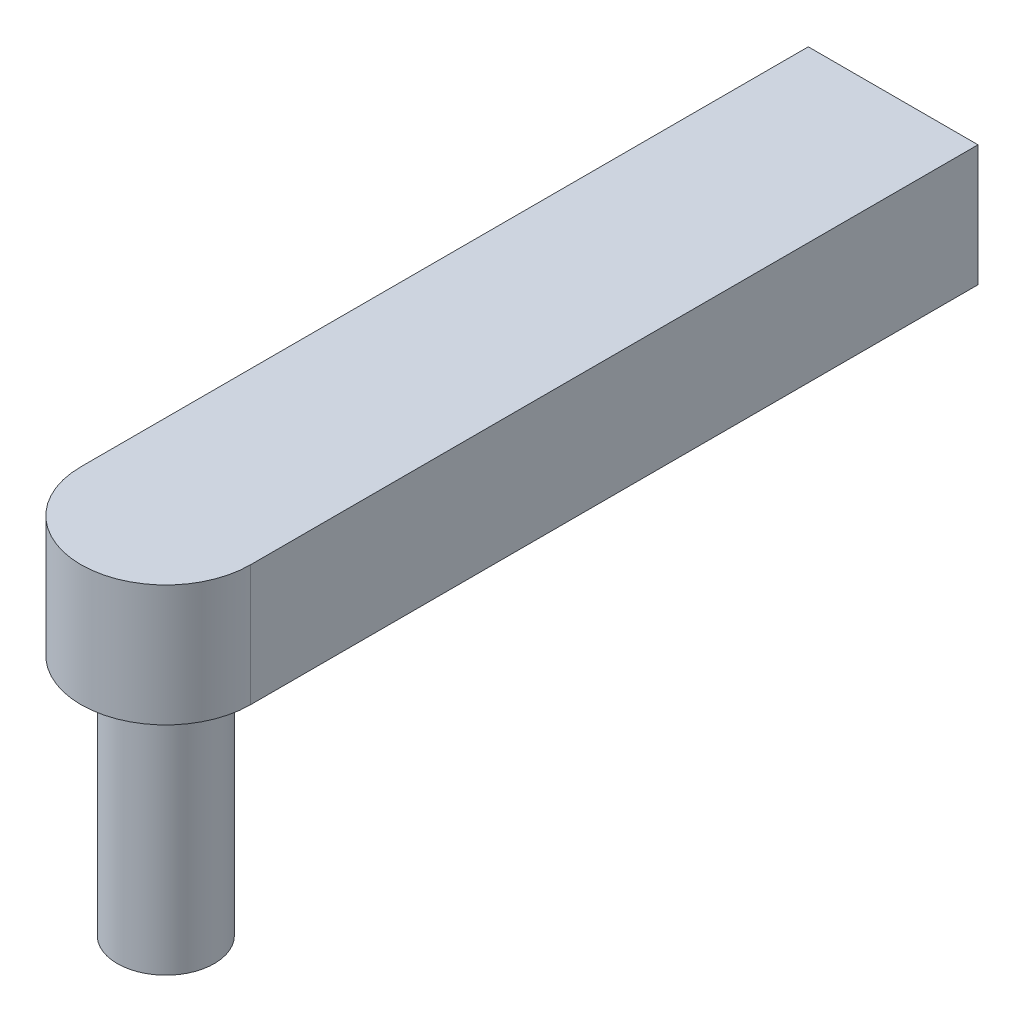
from build123d import *

# Parameters (mm, degrees)
SKETCH_1_R      = 2
EXTRUDE_1_DEPTH = 10
EXTRUDE_2_DEPTH = 5


with BuildPart() as part:
    # Эскиз1 → Бобышка-Вытянуть1 (new body)
    with BuildSketch(Plane(origin=(0, 0, 0), x_dir=(1, 0, 0), z_dir=(0, 1, 0))):
        with Locations(Location((0, 0, 0), (0, 0, 270))):
            Circle(SKETCH_1_R)
    extrude(amount=EXTRUDE_1_DEPTH)

    # Эскиз2 → Бобышка-Вытянуть2 (add)
    with BuildSketch(Plane(origin=(0, 10, 0), x_dir=(1, 0, 0), z_dir=(0, 1, 0))):
        with BuildLine():
            Line((-3.5, 0), (-3.5, 30))
            Line((-3.5, 30), (3.5, 30))
            Line((3.5, 30), (3.5, 0))
            ThreePointArc((3.5, 0), (0, -3.5), (-3.5, 0))
        make_face()
    extrude(amount=EXTRUDE_2_DEPTH)


solid = part.part
